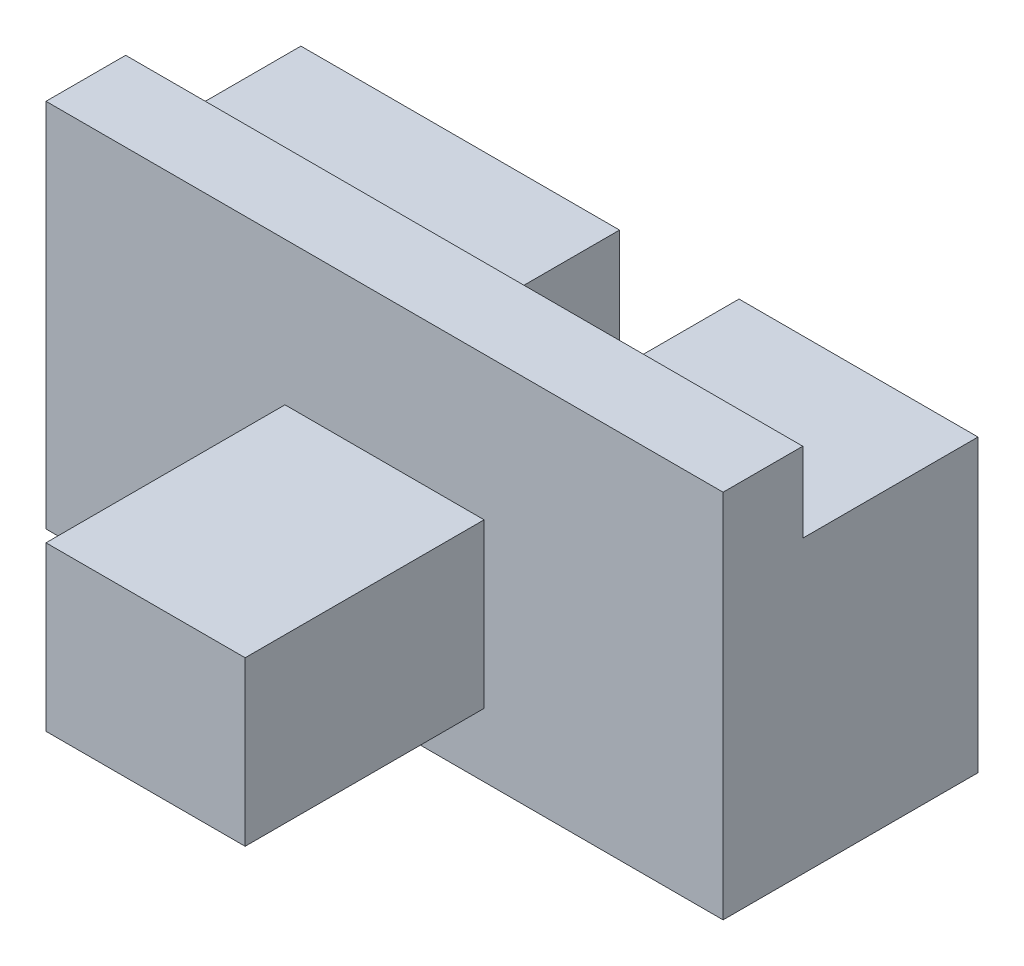
from build123d import *

# Parameters (mm, degrees)
SKETCH1_W           = 8.5
SKETCH1_H           = 3.65
BOSS_EXTRUDE1_DEPTH = 1
SKETCH2_W           = 2.5
SKETCH2_H           = 2.05
BOSS_EXTRUDE2_DEPTH = 3
SKETCH3_W           = 4
SKETCH3_H           = 3.65
SKETCH3_W_2         = 3
BOSS_EXTRUDE3_DEPTH = 2.2
SKETCH4_W           = 8.5
SKETCH4_H           = 1
BOSS_EXTRUDE4_DEPTH = 1


with BuildPart() as part:
    # Sketch1 → Boss-Extrude1 (new body)
    with BuildSketch(Plane.XY):
        Rectangle(SKETCH1_W, SKETCH1_H)
    extrude(amount=BOSS_EXTRUDE1_DEPTH)

    # Sketch2 → Boss-Extrude2 (add)
    with BuildSketch(Plane.XY.offset(1)):
        Rectangle(SKETCH2_W, SKETCH2_H)
    extrude(amount=BOSS_EXTRUDE2_DEPTH)

    # Sketch3 → Boss-Extrude3 (add)
    with BuildSketch(Plane(origin=(0, 0, 0), x_dir=(-1, 0, 0), z_dir=(0, 0, -1))):
        with Locations((2.25, 0)):
            Rectangle(SKETCH3_W, SKETCH3_H)
        with Locations((-2.75, 0)):
            Rectangle(SKETCH3_W_2, SKETCH3_H)
    extrude(amount=BOSS_EXTRUDE3_DEPTH)

    # Sketch4 → Boss-Extrude4 (add)
    with BuildSketch(Plane(origin=(0, 1.825, 0), x_dir=(1, 0, 0), z_dir=(0, 1, 0))):
        with Locations((0, -0.5)):
            Rectangle(SKETCH4_W, SKETCH4_H)
    extrude(amount=BOSS_EXTRUDE4_DEPTH)


solid = part.part
